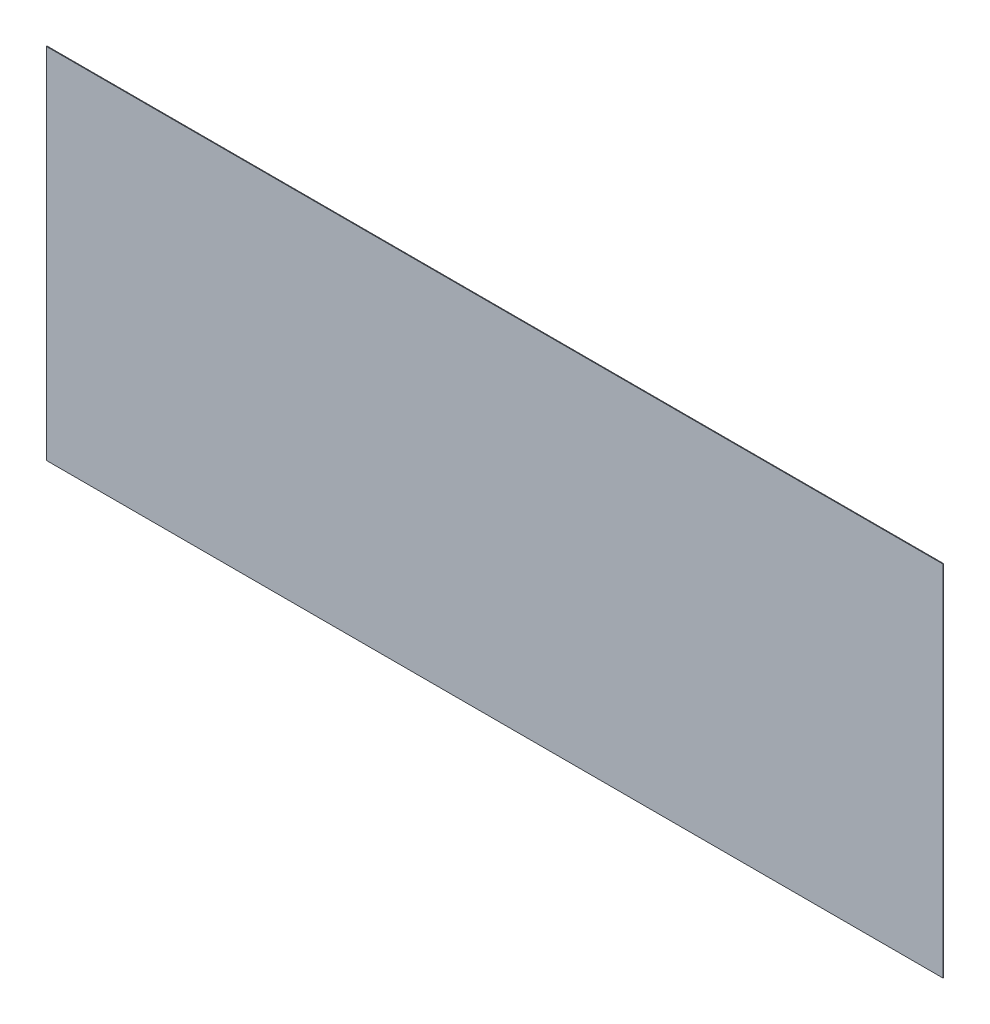
from build123d import *

# Parameters (mm, degrees)
SKETCH_1_W      = 1250
SKETCH_1_H      = 500
EXTRUDE_1_DEPTH = 1


with BuildPart() as part:
    # Эскиз1 → Бобышка-Вытянуть1 (new body)
    with BuildSketch(Plane.XY):
        with Locations((0, 250)):
            Rectangle(SKETCH_1_W, SKETCH_1_H)
    extrude(amount=EXTRUDE_1_DEPTH)


solid = part.part
